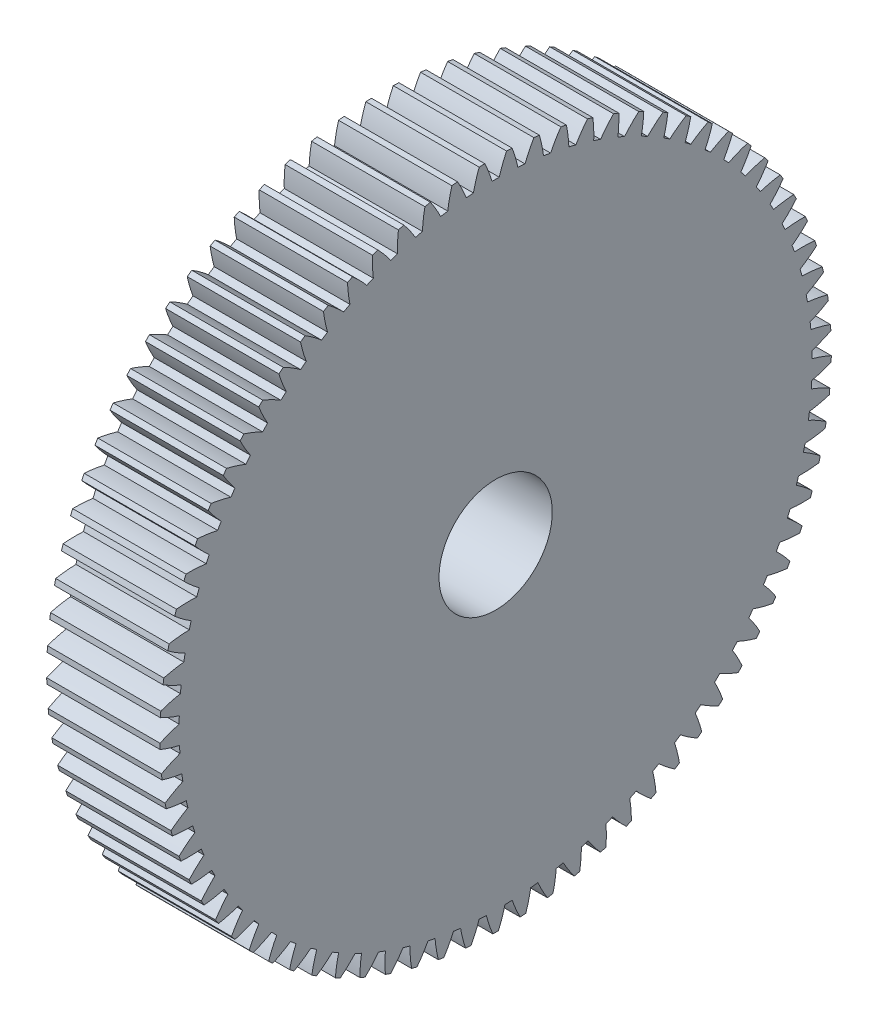
from build123d import *

# Parameters (mm, degrees)
BASPROSKE_W     = 8
BASPROSKE_H     = 23.7
TOOTHCUT_DEPTH  = 35.458380693
TEETHCUTS_COUNT = 77
TEETHCUTS_ANGLE = 355.324675325
BORSKE_R        = 4
BORE_DEPTH      = 50.0000508


with BuildPart() as part:
    # BasProSke → Base-Revolve (revolve)
    with BuildSketch(Plane(origin=(0, 0, 0), x_dir=(1, 0, 0), z_dir=(0, 1, 0)), mode=Mode.PRIVATE) as base_revolve_sk:
        with Locations((4, 11.85)):
            Rectangle(BASPROSKE_W, BASPROSKE_H)
    revolve(base_revolve_sk.sketch.rotate(Axis((-10, 0, 0), (1, 0, 0)), 180), axis=Axis((-10, 0, 0), (1, 0, 0)))

    # TooCutSke → ToothCut (cut, through all)
    with BuildSketch(Plane(origin=(0, 0, 0), x_dir=(0, 0, -1), z_dir=(1, 0, 0))):
        with BuildLine():
            ThreePointArc((0.253233326, 22.347565279), (0, 22.349), (-0.253233326, 22.347565279))
            ThreePointArc((-0.253233326, 22.347565279), (-0.49042371, 23.040522976), (-0.781754461, 23.712517056))
            ThreePointArc((-0.781754461, 23.712517056), (0, 23.7254), (0.781754461, 23.712517056))
            ThreePointArc((0.781754461, 23.712517056), (0.49042371, 23.040522976), (0.253233326, 22.347565279))
        make_face()
    toothcut = extrude(amount=TOOTHCUT_DEPTH, mode=Mode.SUBTRACT)

    # TeethCuts: ToothCut ×77 about axis
    teethcuts_axis = Axis((-10, 0, 0), (1, 0, 0))
    for i in range(1, TEETHCUTS_COUNT):
        add(toothcut.rotate(teethcuts_axis, i * TEETHCUTS_ANGLE / (TEETHCUTS_COUNT - 1)), mode=Mode.SUBTRACT)

    # BorSke → Bore (cut, symmetric)
    with BuildSketch(Plane(origin=(0, 0, 0), x_dir=(0, 0, -1), z_dir=(1, 0, 0))):
        with Locations(Location((0, 0, 0), (0, 0, 180))):
            Circle(BORSKE_R)
    extrude(amount=BORE_DEPTH, both=True, mode=Mode.SUBTRACT)


solid = part.part
